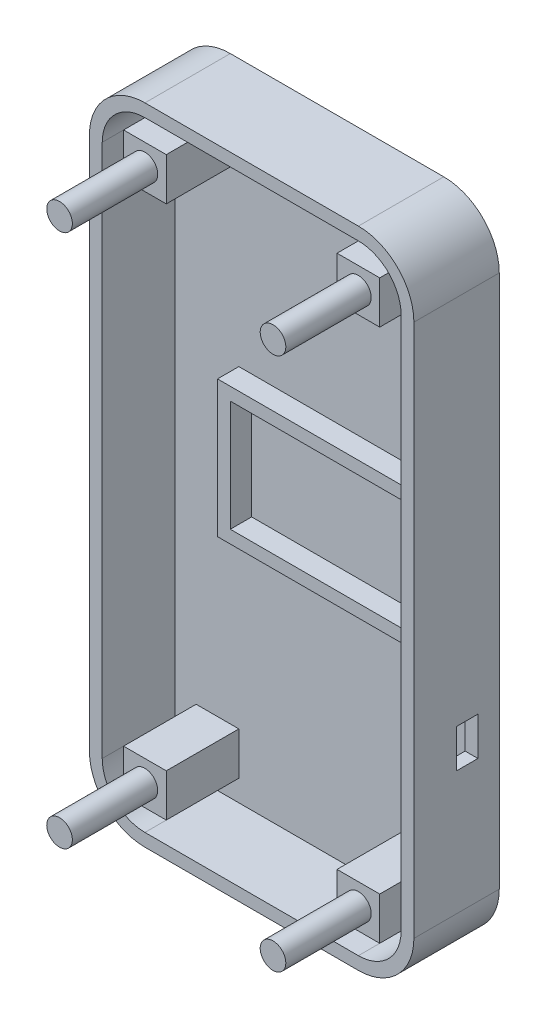
from build123d import *

# Parameters (mm, degrees)
BOSS_EXTRUDE1_DEPTH = 20
BOSS_EXTRUDE2_DEPTH = 3
SKETCH4_W           = 10
SKETCH4_H           = 10
BOSS_EXTRUDE3_DEPTH = 17
SKETCH5_R           = 3
BOSS_EXTRUDE4_DEPTH = 20
SKETCH6_W           = 5
SKETCH6_H           = 9
CUT_EXTRUDE1_DEPTH  = 30
SKETCH7_W           = 58
SKETCH7_H           = 32
SKETCH7_W_2         = 52
SKETCH7_H_2         = 26
BOSS_EXTRUDE5_DEPTH = 5


with BuildPart() as part:
    # Sketch1 → Boss-Extrude1 (new body)
    with BuildSketch(Plane.XY):
        with BuildLine():
            Line((-25, 75.5), (25, 75.5))
            ThreePointArc((25, 75.5), (34.192388155, 71.692388155), (38, 62.5))
            Line((38, 62.5), (38, -62.5))
            ThreePointArc((38, -62.5), (34.192388155, -71.692388155), (25, -75.5))
            Line((25, -75.5), (-25, -75.5))
            ThreePointArc((-25, -75.5), (-34.192388155, -71.692388155), (-38, -62.5))
            Line((-38, -62.5), (-38, 62.5))
            ThreePointArc((-38, 62.5), (-34.192388155, 71.692388155), (-25, 75.5))
        make_face()
        with BuildLine():
            Line((-25, 72.5), (25, 72.5))
            ThreePointArc((25, 72.5), (32.071067812, 69.571067812), (35, 62.5))
            Line((35, 62.5), (35, -62.5))
            ThreePointArc((35, -62.5), (32.071067812, -69.571067812), (25, -72.5))
            Line((25, -72.5), (-25, -72.5))
            ThreePointArc((-25, -72.5), (-32.071067812, -69.571067812), (-35, -62.5))
            Line((-35, -62.5), (-35, 62.5))
            ThreePointArc((-35, 62.5), (-32.071067812, 69.571067812), (-25, 72.5))
        make_face(mode=Mode.SUBTRACT)
    extrude(amount=BOSS_EXTRUDE1_DEPTH)

    # Sketch3 → Boss-Extrude2 (add)
    with BuildSketch(Plane(origin=(0, 0, 0), x_dir=(-1, 0, 0), z_dir=(0, 0, -1))):
        with BuildLine():
            Line((25, -75.5), (-25, -75.5))
            ThreePointArc((-25, -75.5), (-34.192388155, -71.692388155), (-38, -62.5))
            Line((-38, -62.5), (-38, 62.5))
            ThreePointArc((-38, 62.5), (-34.192388155, 71.692388155), (-25, 75.5))
            Line((-25, 75.5), (25, 75.5))
            ThreePointArc((25, 75.5), (34.192388155, 71.692388155), (38, 62.5))
            Line((38, 62.5), (38, -62.5))
            ThreePointArc((38, -62.5), (34.192388155, -71.692388155), (25, -75.5))
        make_face()
    extrude(amount=-BOSS_EXTRUDE2_DEPTH)

    # Sketch4 → Boss-Extrude3 (add)
    with BuildSketch(Plane.XY.offset(3)):
        with Locations((-25, 62.5)):
            Rectangle(SKETCH4_W, SKETCH4_H)
        with Locations((25, 62.5)):
            Rectangle(SKETCH4_W, SKETCH4_H)
        with Locations((25, -62.5)):
            Rectangle(SKETCH4_W, SKETCH4_H)
        with Locations((-25, -62.5)):
            Rectangle(SKETCH4_W, SKETCH4_H)
    extrude(amount=BOSS_EXTRUDE3_DEPTH)

    # Sketch5 → Boss-Extrude4 (add)
    with BuildSketch(Plane.XY.offset(20)):
        with Locations((-25, 62.5)):
            Circle(SKETCH5_R)
        with Locations(Location((25, 62.5, 0), (0, 0, 180))):
            Circle(SKETCH5_R)
        with Locations((25, -62.5)):
            Circle(SKETCH5_R)
        with Locations(Location((-25, -62.5, 0), (0, 0, 180))):
            Circle(SKETCH5_R)
    extrude(amount=BOSS_EXTRUDE4_DEPTH)

    # Sketch6 → Cut-Extrude1 (cut)
    with BuildSketch(Plane(origin=(38, 0, 0), x_dir=(0, 0, -1), z_dir=(1, 0, 0))):
        with Locations((-7.5, -29)):
            Rectangle(SKETCH6_W, SKETCH6_H)
        with Locations((-7.5, -78)):
            Rectangle(SKETCH6_W, SKETCH6_H)
    extrude(amount=-CUT_EXTRUDE1_DEPTH, mode=Mode.SUBTRACT)

    # Sketch7 → Boss-Extrude5 (add)
    with BuildSketch(Plane.XY.offset(3)):
        with Locations((9, 0)):
            Rectangle(SKETCH7_W, SKETCH7_H)
        with Locations((9, 0)):
            Rectangle(SKETCH7_W_2, SKETCH7_H_2, mode=Mode.SUBTRACT)
    extrude(amount=BOSS_EXTRUDE5_DEPTH)


solid = part.part
